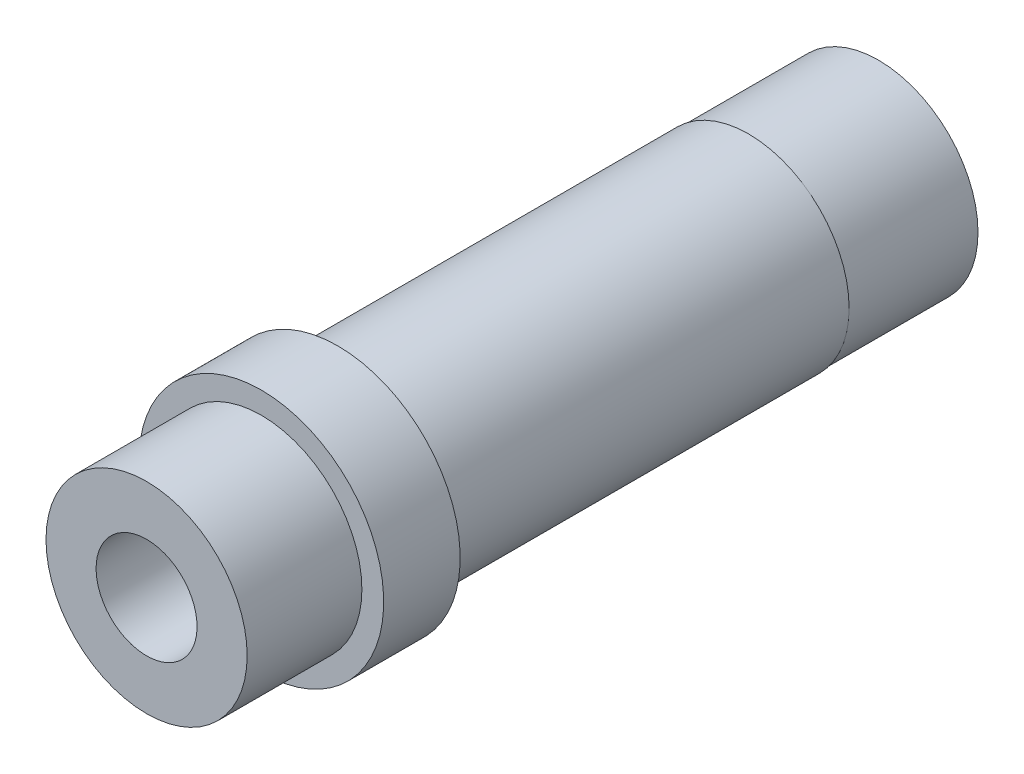
from build123d import *

# Parameters (mm, degrees)
SKETCH2_R          = 66
CUT_EXTRUDE1_DEPTH = 984.386495738


with BuildPart() as part:
    # Sketch1 → Revolve1 (revolve)
    with BuildSketch(Plane(origin=(0, 0, 0), x_dir=(0, 0, -1), z_dir=(1, 0, 0)), mode=Mode.PRIVATE) as revolve1_sk:
        Polygon((0, 160), (100, 160), (100, 131.5), (637, 131.5), (637, 130), (807, 130), (807, 0), (-150, 0), (-150, 131.5), (-100, 131.5), (-50, 131.5), (0, 131.5), align=None)
    revolve(revolve1_sk.sketch.rotate(Axis((0, 0, 150), (0, 0, -1)), 180), axis=Axis((0, 0, 150), (0, 0, -1)))

    # Sketch2 → Cut-Extrude1 (cut, through all)
    with BuildSketch(Plane(origin=(0, 0, -807), x_dir=(-1, 0, 0), z_dir=(0, 0, -1))):
        with Locations(Location((0, 0, 0), (0, 0, 90))):
            Circle(SKETCH2_R)
    extrude(amount=-CUT_EXTRUDE1_DEPTH, mode=Mode.SUBTRACT)


solid = part.part
